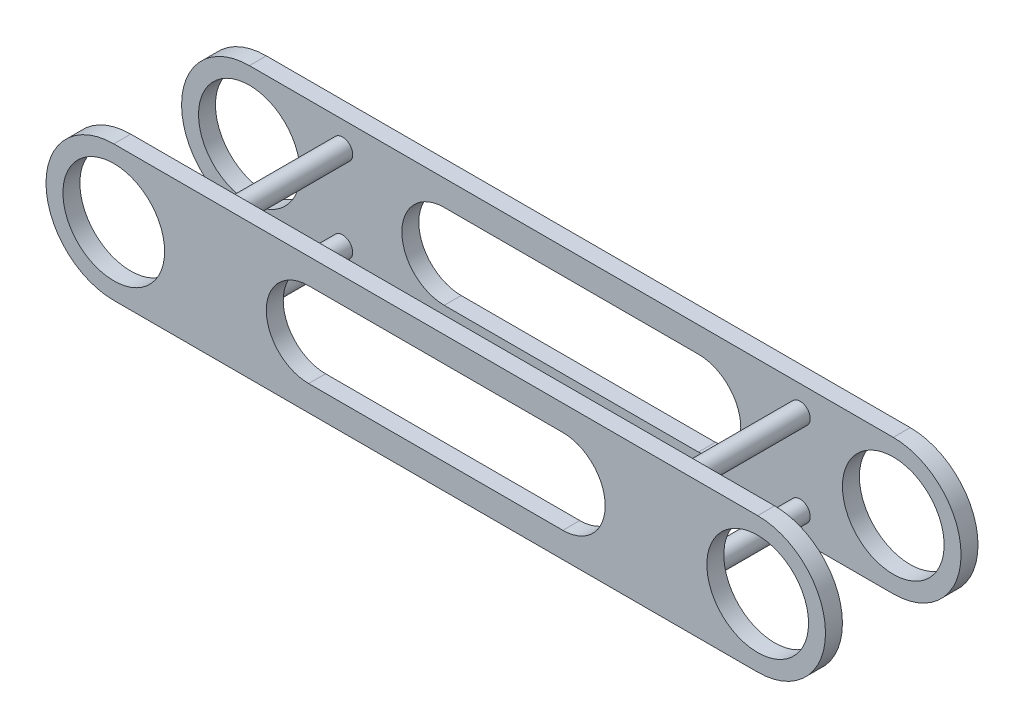
from build123d import *

# Parameters (mm, degrees)
SKETCH2_R           = 30
BOSS_EXTRUDE1_DEPTH = 52.5
BOSS_EXTRUDE2_DEPTH = 10
CUT_EXTRUDE1_DEPTH  = 434.01991871
SKETCH5_R           = 30
BOSS_EXTRUDE3_DEPTH = 52.5
SKETCH7_R           = 6
BOSS_EXTRUDE4_DEPTH = 80
SKETCH8_R           = 30
CUT_EXTRUDE2_DEPTH  = 435.770054167


with BuildPart() as part:
    # Sketch2 → Boss-Extrude1 (new, symmetric)
    with BuildSketch(Plane.XY):
        Circle(SKETCH2_R)
    extrude(amount=BOSS_EXTRUDE1_DEPTH, both=True)

    # Sketch3 → Boss-Extrude2 (add)
    with BuildSketch(Plane.XY.offset(45)):
        with BuildLine():
            Line((0, 40), (380, 40))
            ThreePointArc((380, 40), (420, 0), (380, -40))
            Line((380, -40), (0, -40))
            ThreePointArc((0, -40), (-40, 0), (0, 40))
        make_face()
    boss_extrude2 = extrude(amount=-BOSS_EXTRUDE2_DEPTH)

    # Sketch4 → Cut-Extrude1 (cut, through all)
    with BuildSketch(Plane.XY.offset(45)):
        with BuildLine():
            Line((265, -25), (115, -25))
            ThreePointArc((115, -25), (90, 0), (115, 25))
            Line((115, 25), (265, 25))
            ThreePointArc((265, 25), (290, 0), (265, -25))
        make_face()
    cut_extrude1 = extrude(amount=-CUT_EXTRUDE1_DEPTH, mode=Mode.SUBTRACT)

    # Sketch5 → Boss-Extrude3 (add, symmetric)
    with BuildSketch(Plane.XY):
        with Locations((380, 0)):
            Circle(SKETCH5_R)
    extrude(amount=BOSS_EXTRUDE3_DEPTH, both=True)

    # Mirror1: Boss-Extrude2, Cut-Extrude1 across plane
    add(boss_extrude2.mirror(Plane.XY))
    add(cut_extrude1.mirror(Plane.XY), mode=Mode.SUBTRACT)

    # Sketch7 → Boss-Extrude4 (add)
    with BuildSketch(Plane.XY.offset(45)):
        with Locations((55, 25)):
            Circle(SKETCH7_R)
        with Locations((325, 25)):
            Circle(SKETCH7_R)
        with Locations((325, -25)):
            Circle(SKETCH7_R)
        with Locations((55, -25)):
            Circle(SKETCH7_R)
    extrude(amount=-BOSS_EXTRUDE4_DEPTH)

    # Sketch8 → Cut-Extrude2 (cut, through all)
    with BuildSketch(Plane.XY.offset(52.5)):
        Circle(SKETCH8_R)
        with Locations((380, 0)):
            Circle(SKETCH8_R)
    extrude(amount=-CUT_EXTRUDE2_DEPTH, mode=Mode.SUBTRACT)


solid = part.part
